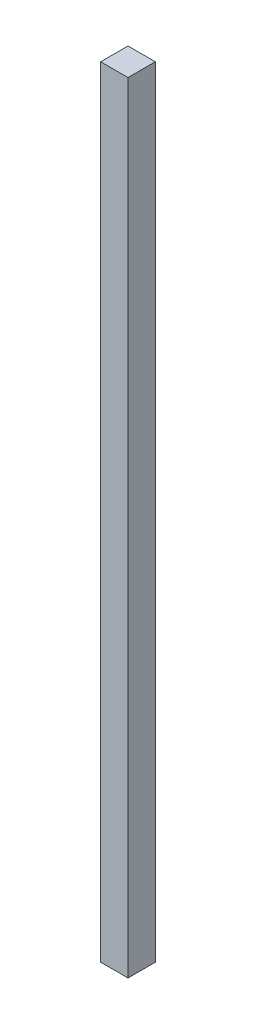
from build123d import *

# Parameters (mm, degrees)
SKETCH2_W           = 70
SKETCH2_H           = 70
BOSS_EXTRUDE1_DEPTH = 2000


with BuildPart() as part:
    # Sketch2 → Boss-Extrude1 (new body)
    with BuildSketch(Plane(origin=(0, 0, 0), x_dir=(1, 0, 0), z_dir=(0, 1, 0))):
        with Locations((10.405405405, -18.783783784)):
            Rectangle(SKETCH2_W, SKETCH2_H)
    extrude(amount=BOSS_EXTRUDE1_DEPTH)


solid = part.part
